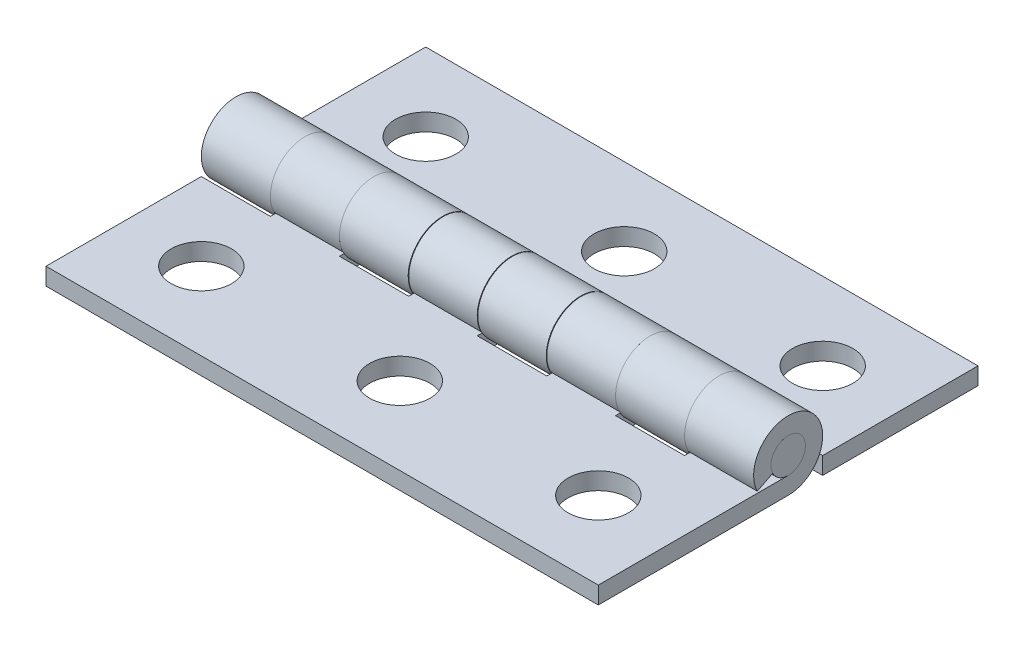
from build123d import *

# Parameters (mm, degrees)
BOSS_EXTRUDE1_DEPTH     = 25.4
SKETCH4_W               = 6.35
SKETCH4_H               = 6.35
CUT_EXTRUDE1_DEPTH      = 31.986763807
LPATTERN1_COUNT         = 3
LPATTERN1_PITCH         = 12.7
LPATTERN1_COL_COUNT     = 2
LPATTERN1_COL_PITCH     = 12.7
CUT_EXTRUDE2_DEPTH      = 32.189426293
CUT_EXTRUDE2_DEPTH_BACK = 32.189426293
SKETCH5_W               = 0.0254
SKETCH5_H               = 6.35
SKETCH6_R               = 2.778125
CUT_EXTRUDE3_DEPTH      = 32.189426293
CIRPATTERN1_COUNT       = 2
SKETCH8_R               = 1.5875
BOSS_EXTRUDE2_DEPTH     = 25.4


with BuildPart() as part:
    # Sketch3 → Boss-Extrude1 (new, symmetric)
    with BuildSketch(Plane(origin=(0, 0, 0), x_dir=(0, 0, -1), z_dir=(1, 0, 0))):
        with BuildLine():
            Line((0, -3.175), (-17.4625, -3.175))
            Line((-17.4625, -3.175), (-17.4625, -1.5875))
            Line((-17.4625, -1.5875), (0, -1.5875))
            ThreePointArc((0, -1.5875), (0.83459814, 1.350408158), (-1.419903166, -0.709951583))
            Line((-1.419903166, -0.709951583), (-2.839806331, -1.419903166))
            ThreePointArc((-2.839806331, -1.419903166), (1.669196281, 2.700816317), (0, -3.175))
        make_face()
    extrude(amount=BOSS_EXTRUDE1_DEPTH, both=True)

    # Sketch4 → Cut-Extrude1 (cut, symmetric)
    with BuildSketch(Plane(origin=(0, 0, 0), x_dir=(1, 0, 0), z_dir=(0, 1, 0))):
        with Locations((3.175, 0)):
            Rectangle(SKETCH4_W, SKETCH4_H)
    cut_extrude1 = extrude(amount=CUT_EXTRUDE1_DEPTH, both=True, mode=Mode.SUBTRACT)

    # LPattern1: Cut-Extrude1 ×3
    with Locations(*[(-i * LPATTERN1_PITCH, 0, 0) for i in range(1, LPATTERN1_COUNT)]):
        add(cut_extrude1, mode=Mode.SUBTRACT)

    # LPattern1 col: Cut-Extrude1 ×2
    with Locations(*[(i * LPATTERN1_COL_PITCH, 0, 0) for i in range(1, LPATTERN1_COL_COUNT)]):
        add(cut_extrude1, mode=Mode.SUBTRACT)

    # Sketch5 → Cut-Extrude2 (cut, two sides: drawn at the far end of the back side and taken through both)
    with BuildSketch(Plane(origin=(0, -1.5875, 0), x_dir=(1, 0, 0), z_dir=(0, 1, 0)).offset(-CUT_EXTRUDE2_DEPTH_BACK)):
        with Locations((-6.3373, 0)):
            Rectangle(SKETCH5_W, SKETCH5_H)
        with Locations((-0.0127, 0)):
            Rectangle(SKETCH5_W, SKETCH5_H)
        with Locations((6.3627, 0)):
            Rectangle(SKETCH5_W, SKETCH5_H)
    extrude(amount=CUT_EXTRUDE2_DEPTH + CUT_EXTRUDE2_DEPTH_BACK, mode=Mode.SUBTRACT)

    # Sketch6 → Cut-Extrude3 (cut, through all)
    with BuildSketch(Plane(origin=(0, -1.5875, 0), x_dir=(1, 0, 0), z_dir=(0, 1, 0))):
        with Locations(Location((18.25625, -10.31875, 0), (0, 0, 270))):
            Circle(SKETCH6_R)
        with Locations(Location((-18.25625, -10.31875, 0), (0, 0, 270))):
            Circle(SKETCH6_R)
        with Locations(Location((0, -10.31875, 0), (0, 0, 270))):
            Circle(SKETCH6_R)
    extrude(amount=-CUT_EXTRUDE3_DEPTH, mode=Mode.SUBTRACT)


with BuildPart() as cirpattern1_1:
    # CirPattern1: pattern copy
    add(part.part.rotate(Axis((0, 0, 0), (0, 1, 0)), 1 * 360 / CIRPATTERN1_COUNT))


with BuildPart() as body_3:
    # Sketch8 → Boss-Extrude2 (new, symmetric)
    with BuildSketch(Plane(origin=(0, 0, 0), x_dir=(0, 0, -1), z_dir=(1, 0, 0))):
        Circle(SKETCH8_R)
    extrude(amount=BOSS_EXTRUDE2_DEPTH, both=True)


solid = Compound([part.part, cirpattern1_1.part, body_3.part])
